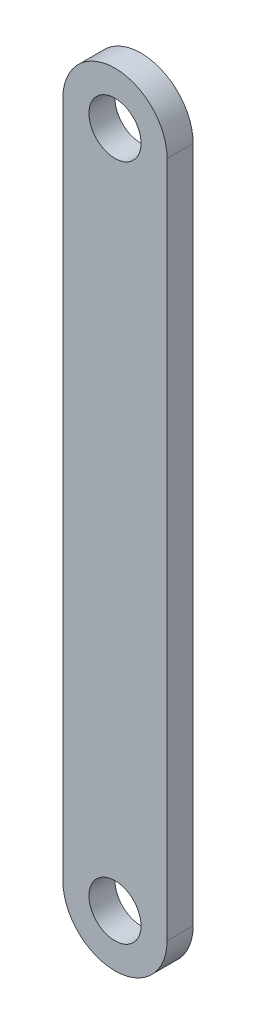
from build123d import *

# Parameters (mm, degrees)
SKETCH1_R           = 12.7
BOSS_EXTRUDE1_DEPTH = 12.7


with BuildPart() as part:
    # Sketch1 → Boss-Extrude1 (new body)
    with BuildSketch(Plane.XY):
        with BuildLine():
            Line((-25.4, -330.2), (-25.4, 0))
            ThreePointArc((-25.4, 0), (0, 25.4), (25.4, 0))
            Line((25.4, 0), (25.4, -330.2))
            ThreePointArc((25.4, -330.2), (0, -355.6), (-25.4, -330.2))
        make_face()
        Circle(SKETCH1_R, mode=Mode.SUBTRACT)
        with Locations((0, -330.2)):
            Circle(SKETCH1_R, mode=Mode.SUBTRACT)
    extrude(amount=BOSS_EXTRUDE1_DEPTH)


solid = part.part
